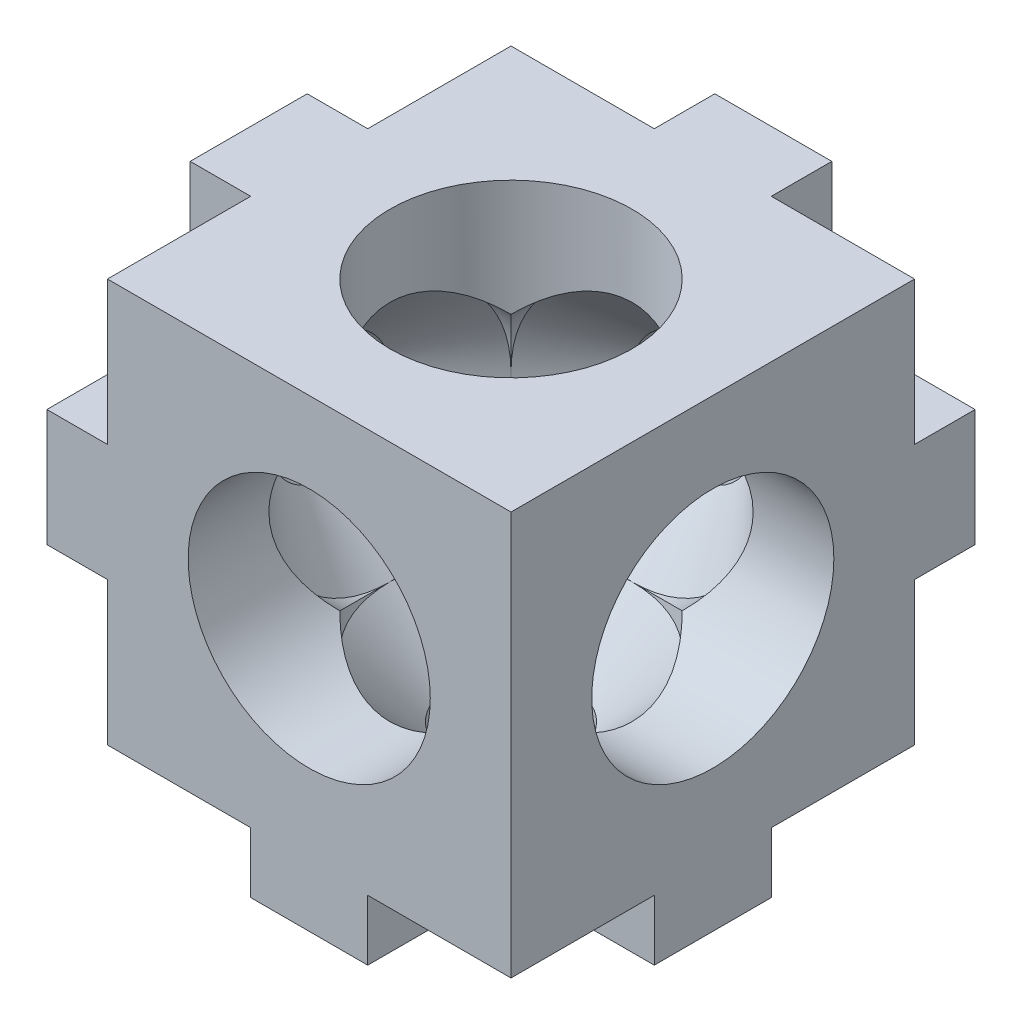
from build123d import *

# Parameters (mm, degrees)
SKETCH1_W           = 20
SKETCH1_H           = 20
BOSS_EXTRUDE1_DEPTH = 10
SKETCH_Z_R          = 6
CUT_EXTRUDE1_DEPTH  = 16
SKETCH_Y_R          = 6
CUT_EXTRUDE2_DEPTH  = 16
SKETCH_X_R          = 6
CUT_EXTRUDE3_DEPTH  = 16
SKETCH32_W          = 5.4
SKETCH32_H          = 3
SKETCH32_W_2        = 3
SKETCH32_H_2        = 5.4
CON_DEPTH           = 2.9
CIRPATTERN5_COUNT   = 2
CIRPATTERN5_ANGLE   = 270
CIRPATTERN9_COUNT   = 2
CIRPATTERN9_ANGLE   = 90


with BuildPart() as part:
    # Sketch1 → Boss-Extrude1 (new, symmetric)
    with BuildSketch(Plane(origin=(0, 0, 0), x_dir=(1, 0, 0), z_dir=(0, 1, 0))):
        Rectangle(SKETCH1_W, SKETCH1_H)
    extrude(amount=BOSS_EXTRUDE1_DEPTH, both=True)

    # Sketch Z → Cut-Extrude1 (cut)
    with BuildSketch(Plane.XY.offset(10)):
        Circle(SKETCH_Z_R)
    extrude(amount=-CUT_EXTRUDE1_DEPTH, mode=Mode.SUBTRACT)

    # Sketch Y → Cut-Extrude2 (cut)
    with BuildSketch(Plane(origin=(0, 10, 0), x_dir=(1, 0, 0), z_dir=(0, 1, 0))):
        with Locations(Location((0, 0, 0), (0, 0, 270))):
            Circle(SKETCH_Y_R)
    extrude(amount=-CUT_EXTRUDE2_DEPTH, mode=Mode.SUBTRACT)

    # Sketch X → Cut-Extrude3 (cut)
    with BuildSketch(Plane(origin=(10, 0, 0), x_dir=(0, 0, -1), z_dir=(1, 0, 0))):
        Circle(SKETCH_X_R)
    extrude(amount=-CUT_EXTRUDE3_DEPTH, mode=Mode.SUBTRACT)

    # Sketch23 → CSK for M6 Flat Head Machine Screw23 (revolve, cut)
    with BuildSketch(Plane(origin=(-6, 0, 0), x_dir=(0, 0, -1), z_dir=(0, 1, 0))):
        Polygon((0, 0), (0, 4), (3, 4), (3, 3), (6, 0), align=None)
    revolve(axis=Axis((0.35, 0, 0), (-1, 0, 0)), mode=Mode.SUBTRACT)

    # Sketch24 → CSK for M6 Flat Head Machine Screw24 (revolve, cut)
    with BuildSketch(Plane(origin=(0, 0, -6), x_dir=(0, -1, 0), z_dir=(1, 0, 0))):
        Polygon((0, 0), (0, 4), (3, 4), (3, 3), (6, 0), align=None)
    revolve(axis=Axis((0, 0, 0.35), (0, 0, -1)), mode=Mode.SUBTRACT)

    # Sketch26 → CSK for M6 Flat Head Machine Screw25 (revolve, cut)
    with BuildSketch(Plane(origin=(0, -6, 0), x_dir=(0, 0, 1), z_dir=(1, 0, 0))):
        Polygon((0, 0), (0, 4), (3, 4), (3, 3), (6, 0), align=None)
    revolve(axis=Axis((0, 0.35, 0), (0, -1, 0)), mode=Mode.SUBTRACT)

    # Sketch32 → con (add, symmetric)
    with BuildSketch(Plane.XY):
        Polygon((-10, -10), (-10, -4.6), (-13, -4.6), (-13, -11), (-11, -13), (-4.6, -13), (-4.6, -10), align=None)
        with Locations((7.3, -11.5)):
            Rectangle(SKETCH32_W, SKETCH32_H)
        with Locations((-11.5, 7.3)):
            Rectangle(SKETCH32_W_2, SKETCH32_H_2)
    con = extrude(amount=CON_DEPTH, both=True)

    # CirPattern5: con ×2 about axis
    cirpattern5_axis = Axis((0, 0, 0), (0, 1, 0))
    for i in range(1, CIRPATTERN5_COUNT):
        add(con.rotate(cirpattern5_axis, i * CIRPATTERN5_ANGLE / (CIRPATTERN5_COUNT - 1)))

    # CirPattern9: con ×2 about axis
    cirpattern9_axis = Axis((0, 0, 0), (1, 0, 0))
    for i in range(1, CIRPATTERN9_COUNT):
        add(con.rotate(cirpattern9_axis, i * CIRPATTERN9_ANGLE / (CIRPATTERN9_COUNT - 1)))


solid = part.part
